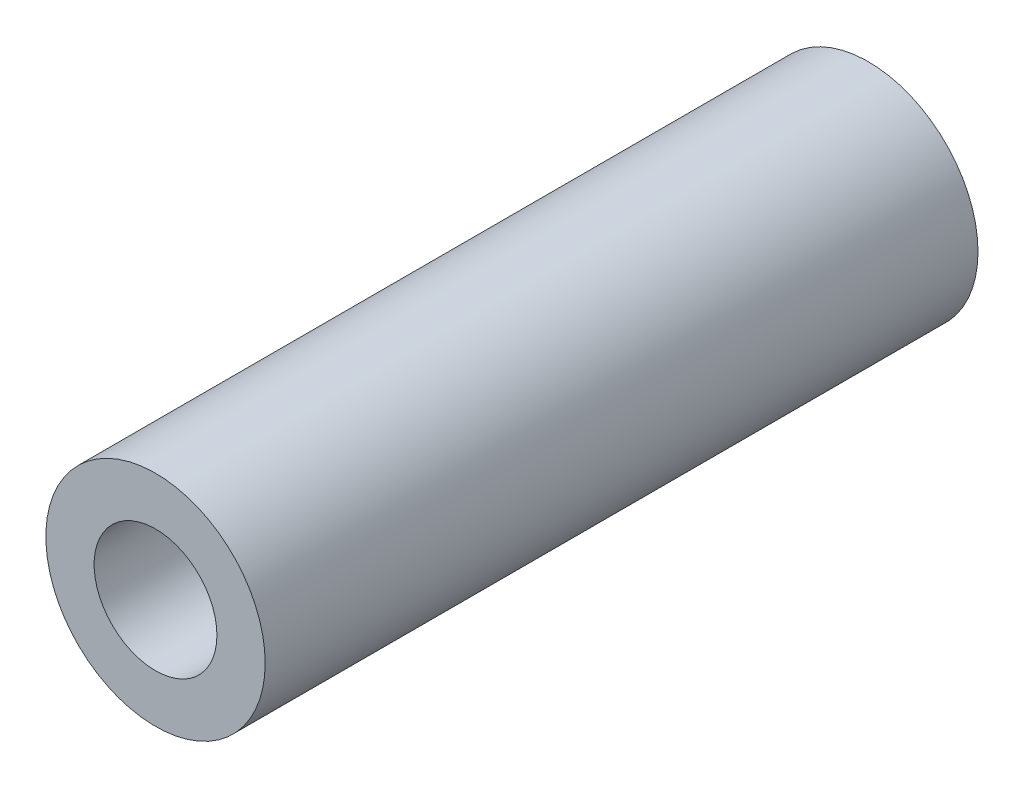
from build123d import *

# Parameters (mm, degrees)
SKETCH1_R      = 3.175
SKETCH1_R_2    = 1.778
EXTRUDE1_DEPTH = 10.31875


with BuildPart() as part:
    # Sketch1 → Extrude1 (new, symmetric)
    with BuildSketch(Plane.XY):
        Circle(SKETCH1_R)
        Circle(SKETCH1_R_2, mode=Mode.SUBTRACT)
    extrude(amount=EXTRUDE1_DEPTH, both=True)


solid = part.part
